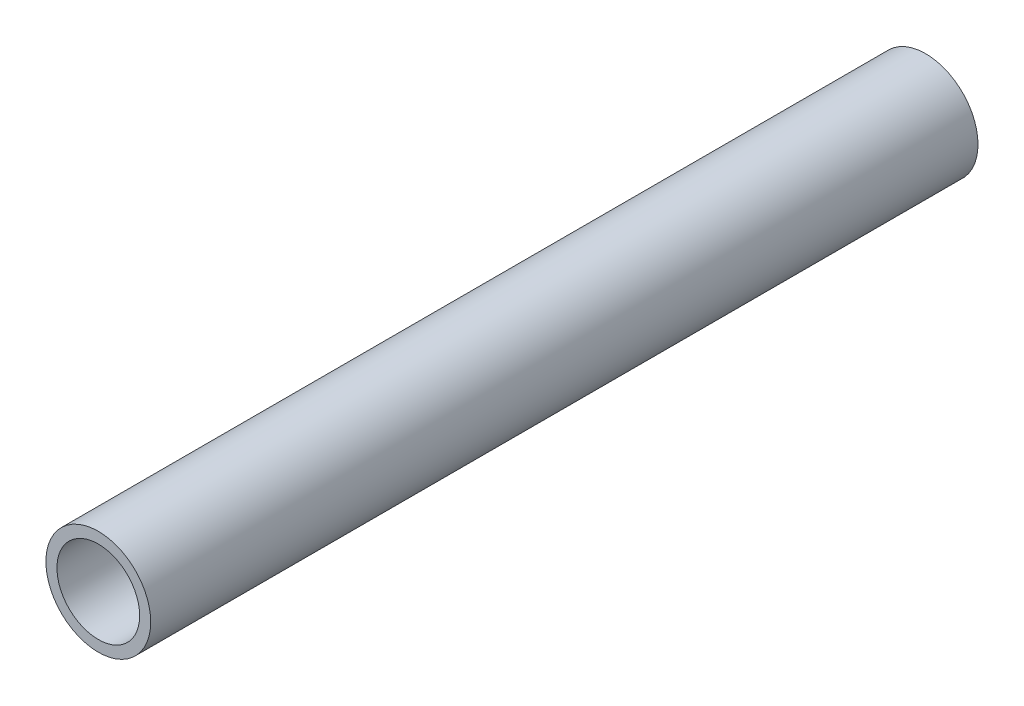
from build123d import *

# Parameters (mm, degrees)
SKETCH_1_R      = 19
SKETCH_1_R_2    = 15
EXTRUDE_1_DEPTH = 300


with BuildPart() as part:
    # ｽｹｯﾁ1 → ﾎﾞｽ - 押し出し1 (new body)
    with BuildSketch(Plane.XY):
        Circle(SKETCH_1_R)
        Circle(SKETCH_1_R_2, mode=Mode.SUBTRACT)
    extrude(amount=EXTRUDE_1_DEPTH)


solid = part.part
